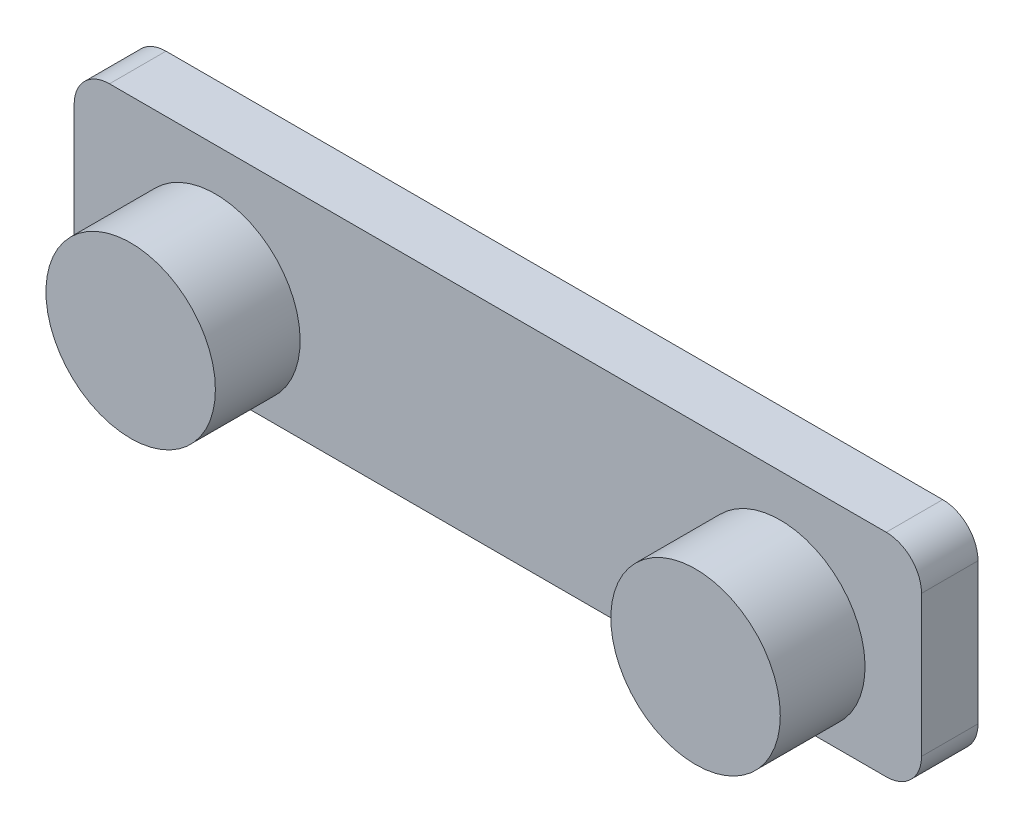
from build123d import *

# Parameters (mm, degrees)
BASEPLATE_DEPTH = 8
SKETCH_4_R      = 12
PIVOTA_DEPTH    = 20
SKETCH_5_R      = 12
PIVOTD_DEPTH    = 20


with BuildPart() as part:
    # 草图3 → BasePlate (new body)
    with BuildSketch(Plane.XY):
        with BuildLine():
            Line((85, 0), (195, 0))
            ThreePointArc((195, 0), (198.535533906, 1.464466094), (200, 5))
            Line((200, 5), (200, 25))
            ThreePointArc((200, 25), (198.535533906, 28.535533906), (195, 30))
            Line((195, 30), (85, 30))
            ThreePointArc((85, 30), (81.464466094, 28.535533906), (80, 25))
            Line((80, 25), (80, 5))
            ThreePointArc((80, 5), (81.464466094, 1.464466094), (85, 0))
        make_face()
    extrude(amount=BASEPLATE_DEPTH)

    # 草图4 → PivotA (add)
    with BuildSketch(Plane.XY):
        with Locations(Location((100, 12, 0), (0, 0, 270))):
            Circle(SKETCH_4_R)
    extrude(amount=PIVOTA_DEPTH)

    # 草图5 → PivotD (add)
    with BuildSketch(Plane.XY):
        with Locations(Location((180, 12, 0), (0, 0, 270))):
            Circle(SKETCH_5_R)
    extrude(amount=PIVOTD_DEPTH)


solid = part.part
